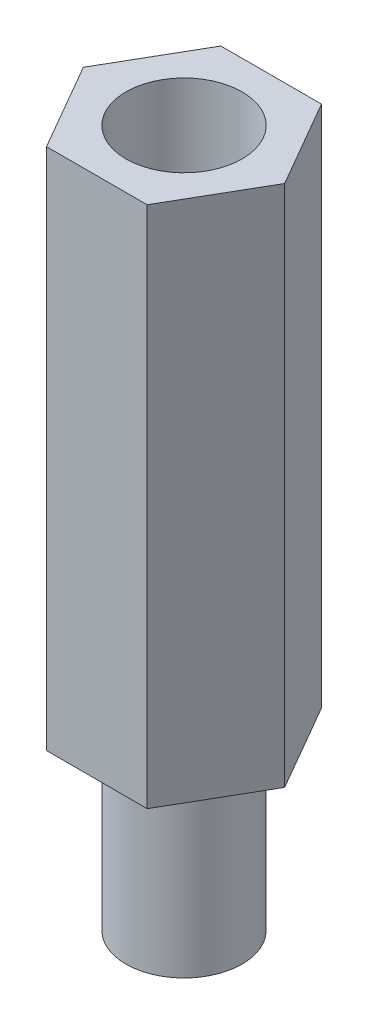
from build123d import *

# Parameters (mm, degrees)
SKETCH_2_R      = 2
EXTRUDE_1_DEPTH = 18
SKETCH_2_2_R    = 2
EXTRUDE_2_DEPTH = 6


with BuildPart() as part:
    # 草图2 → 凸台-拉伸1 (new body)
    with BuildSketch(Plane(origin=(0, 0, 0), x_dir=(1, 0, 0), z_dir=(0, 1, 0))):
        Polygon((3.464101615, 0), (1.732050808, 3), (-1.732050808, 3), (-3.464101615, 0), (-1.732050808, -3), (1.732050808, -3), align=None)
        Circle(SKETCH_2_R, mode=Mode.SUBTRACT)
    extrude(amount=EXTRUDE_1_DEPTH)


with BuildPart() as body_2:
    # 草图2<2> → 凸台-拉伸2 (new body)
    with BuildSketch(Plane(origin=(0, 0, 0), x_dir=(1, 0, 0), z_dir=(0, 1, 0))):
        Circle(SKETCH_2_2_R)
    extrude(amount=-EXTRUDE_2_DEPTH)


solid = Compound([part.part, body_2.part])
